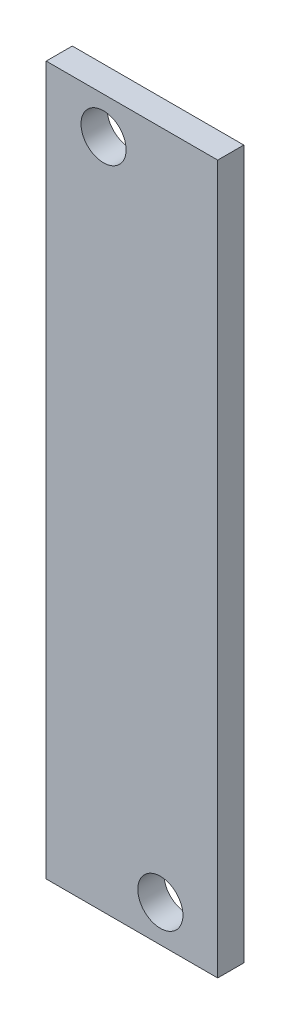
from build123d import *

# Parameters (mm, degrees)
SKETCH1_W           = 23
SKETCH1_H           = 95
SKETCH1_R           = 3.025
BOSS_EXTRUDE1_DEPTH = 3.5


with BuildPart() as part:
    # Sketch1 → Boss-Extrude1 (new body)
    with BuildSketch(Plane.XY):
        Rectangle(SKETCH1_W, SKETCH1_H)
        with Locations((-3.81, 42.55135)):
            Circle(SKETCH1_R, mode=Mode.SUBTRACT)
        with Locations((3.81, -42.55135)):
            Circle(SKETCH1_R, mode=Mode.SUBTRACT)
    extrude(amount=BOSS_EXTRUDE1_DEPTH)


solid = part.part
